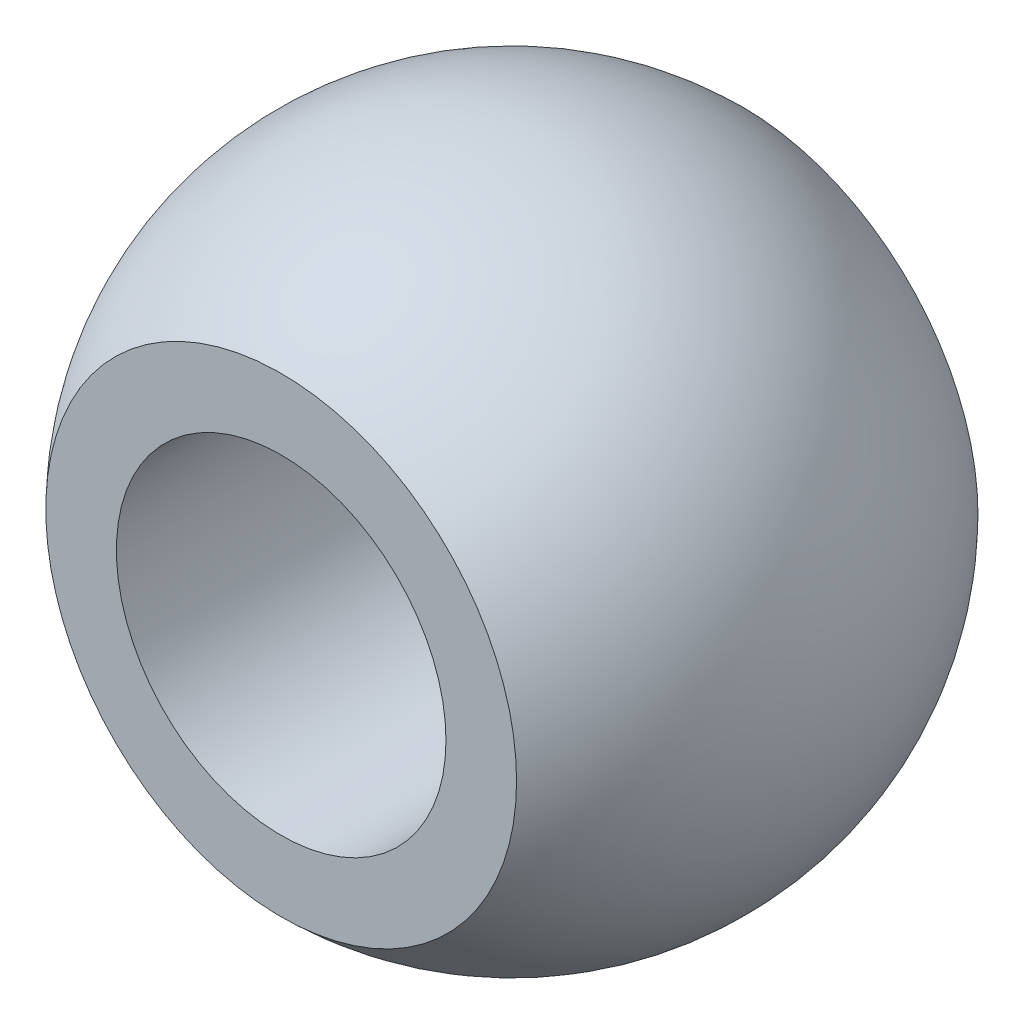
from build123d import *

# Parameters (mm, degrees)
SKETCH2_R      = 3.96875
EXTRUDE1_DEPTH = 25.4
EXTRUDE2_REACH = 19.552
SKETCH3_R      = 7.9375


with BuildPart() as part:
    # Sketch1 → Revolve1 (revolve)
    with BuildSketch(Plane.XY):
        with BuildLine():
            Line((0, 7.9375), (0, -7.9375))
            ThreePointArc((0, -7.9375), (7.9375, 0), (0, 7.9375))
        make_face()
    revolve(axis=Axis((0, -7.9375, 0), (0, 1, 0)))

    # Sketch2 → Extrude1 (cut, symmetric)
    with BuildSketch(Plane.XY):
        with Locations(Location((0, 0, 0), (0, 0, 180))):
            Circle(SKETCH2_R)
    extrude(amount=EXTRUDE1_DEPTH, both=True, mode=Mode.SUBTRACT)

    # Sketch3 → Extrude2 (cut, up to next)
    with BuildSketch(Plane.XY.offset(5.55625), mode=Mode.PRIVATE) as extrude2_sk1:
        Circle(SKETCH3_R)
    extrude2_tool1 = extrude(extrude2_sk1.sketch, amount=EXTRUDE2_REACH, mode=Mode.PRIVATE) & part.part
    extrude2 = extrude2_tool1.solids().sort_by_distance((0, 0, 5.55625))[0]
    add(extrude2, mode=Mode.SUBTRACT)

    # Mirror1: Extrude2 across plane
    add(extrude2.mirror(Plane.XY), mode=Mode.SUBTRACT)


solid = part.part
